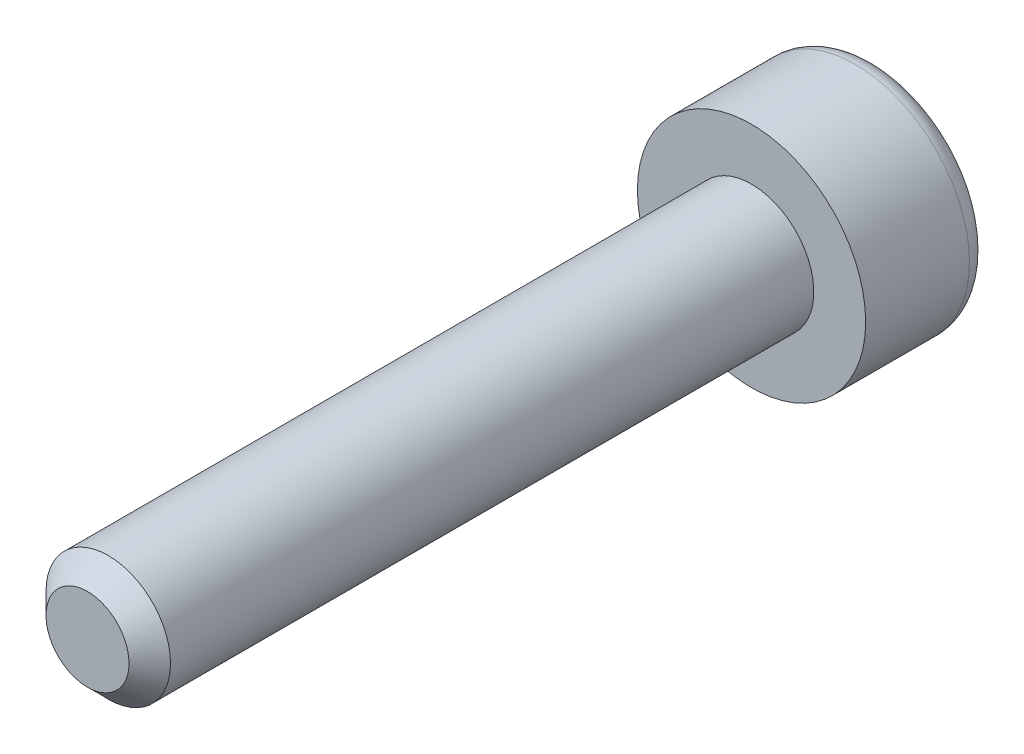
from build123d import *

# Parameters (mm, degrees)
ESQUISSE1_R             = 1.5
BASE_EXTRUSION_DEPTH    = 16
CHANFREIN1_SIZE         = 0.5
ESQUISSE2_R             = 2.75
BOSS_EXTRU_1_DEPTH      = 3
CONG_1_R                = 0.5
ENL_V_MAT_EXTRU_1_DEPTH = 2


with BuildPart() as part:
    # Esquisse1 → Base-Extrusion (new body)
    with BuildSketch(Plane.XY):
        Circle(ESQUISSE1_R)
    extrude(amount=BASE_EXTRUSION_DEPTH)

    # Chanfrein1
    chanfrein1_edges = [part.edges().sort_by_distance(p)[0] for p in [
        (-1.5, 0, 16),
    ]]
    chamfer(chanfrein1_edges, length=CHANFREIN1_SIZE)

    # Esquisse2 → Boss.-Extru.1 (add)
    with BuildSketch(Plane(origin=(0, 0, 0), x_dir=(-1, 0, 0), z_dir=(0, 0, -1))):
        Circle(ESQUISSE2_R)
    extrude(amount=BOSS_EXTRU_1_DEPTH)

    # Congé1
    cong_1_edges = [part.edges().sort_by_distance(p)[0] for p in [
        (2.75, 0, -3),
    ]]
    fillet(cong_1_edges, radius=CONG_1_R)

    # Esquisse3 → Enlèv. mat.-Extru.1 (cut)
    with BuildSketch(Plane(origin=(0, 0, -3), x_dir=(-1, 0, 0), z_dir=(0, 0, -1))):
        Polygon((0, 1.732050808), (-1.5, 0.866025404), (-1.5, -0.866025404), (0, -1.732050808), (1.5, -0.866025404), (1.5, 0.866025404), align=None)
    extrude(amount=-ENL_V_MAT_EXTRU_1_DEPTH, mode=Mode.SUBTRACT)


solid = part.part
